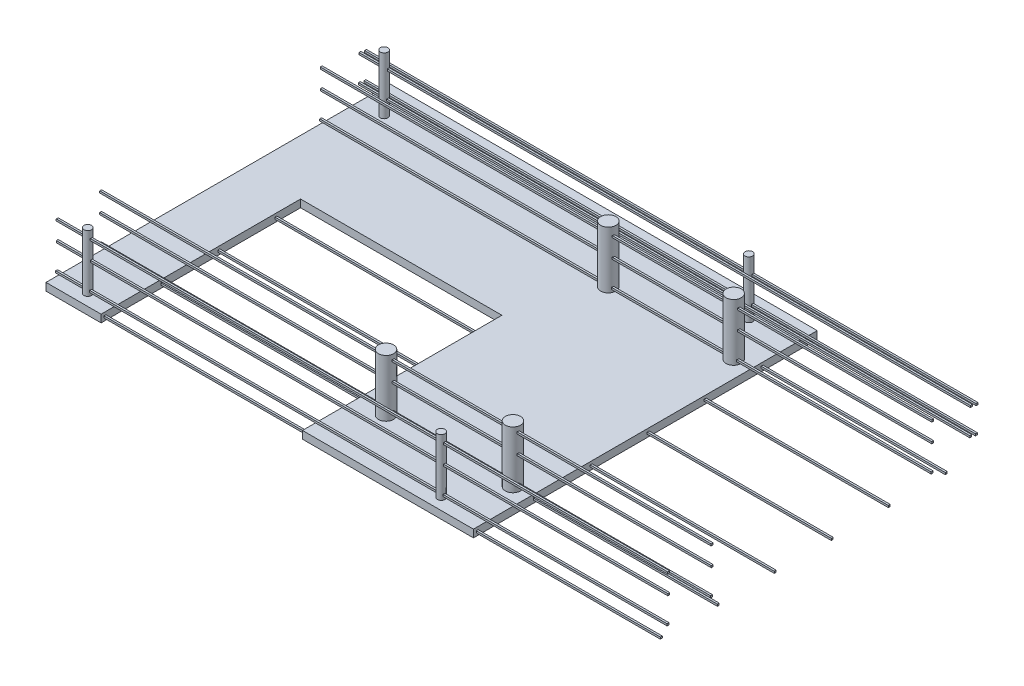
from build123d import *

# Parameters (mm, degrees)
SKETCH_1_W               = 120
SKETCH_1_H               = 120
EXTRUDE_1_DEPTH          = 2
SKETCH_2_R               = 2
SKETCH_2_R_2             = 1
EXTRUDE_2_DEPTH          = 15
SKETCH_3_W               = 53
SKETCH_3_H               = 18
SKETCH_3_W_2             = 45
SKETCH_3_W_3             = 14.5
SKETCH_3_W_4             = 7.5
SKETCH_3_H_2             = 13
SKETCH_3_H_3             = 89
CUT_EXTRUDE_3_DEPTH      = 15
SKETCH_4_W               = 53
SKETCH_4_H               = 64
CUT_EXTRUDE_4_DEPTH      = 15
CUT_EXTRUDE_5_DEPTH      = 87.168439698
CUT_EXTRUDE_5_DEPTH_BACK = 10
SKETCH_5_W               = 45
SKETCH_5_H               = 11.5
SKETCH_5_W_2             = 14.5
EXTRUDE_START            = -98
SKETCH_7_W               = 0.5
SKETCH_7_H               = 0.5
EXTRUDE_3_DEPTH          = 146.454657
EXTRUDE_START_2          = -112.5
SKETCH_8_W               = 0.5
SKETCH_8_H               = 0.5
EXTRUDE_4_DEPTH          = 160.954657


with BuildPart() as part:
    # 스케치1 → 보스-돌출1 (new body)
    with BuildSketch(Plane(origin=(0, 0, 0), x_dir=(1, 0, 0), z_dir=(0, 1, 0))):
        Rectangle(SKETCH_1_W, SKETCH_1_H)
    extrude(amount=EXTRUDE_1_DEPTH)

    # 스케치2 → 보스-돌출2 (add)
    with BuildSketch(Plane(origin=(0, 2, 0), x_dir=(1, 0, 0), z_dir=(0, 1, 0))):
        with Locations(Location((55.5, 24.5, 0), (0, 0, 270))):
            Circle(SKETCH_2_R)
        with Locations(Location((55.5, -33.6, 0), (0, 0, 270))):
            Circle(SKETCH_2_R)
        with Locations(Location((48.5, -45.5, 0), (0, 0, 270))):
            Circle(SKETCH_2_R_2)
        with Locations(Location((22.5, -34, 0), (0, 0, 270))):
            Circle(SKETCH_2_R)
        with Locations(Location((22.5, 24.5, 0), (0, 0, 270))):
            Circle(SKETCH_2_R)
        with Locations(Location((48.5, 35.5, 0), (0, 0, 270))):
            Circle(SKETCH_2_R_2)
        with Locations(Location((-46, 34, 0), (0, 0, 270))):
            Circle(SKETCH_2_R_2)
        with Locations(Location((-44.5, -45.5, 0), (0, 0, 270))):
            Circle(SKETCH_2_R_2)
    extrude(amount=EXTRUDE_2_DEPTH)

    # 스케치3 → 컷-돌출3 (cut)
    with BuildSketch(Plane(origin=(0, 2, 0), x_dir=(1, 0, 0), z_dir=(0, 1, 0))):
        with Locations((-11.5, 51)):
            Rectangle(SKETCH_3_W, SKETCH_3_H)
        with Locations((37.5, 51)):
            Rectangle(SKETCH_3_W_2, SKETCH_3_H)
        with Locations((-45.25, 51)):
            Rectangle(SKETCH_3_W_3, SKETCH_3_H)
        with Locations((-56.25, 51)):
            Rectangle(SKETCH_3_W_4, SKETCH_3_H)
        with Locations((-56.25, 35.5)):
            Rectangle(SKETCH_3_W_4, SKETCH_3_H_2)
        with Locations((-56.25, -15.5)):
            Rectangle(SKETCH_3_W_4, SKETCH_3_H_3)
    extrude(amount=-CUT_EXTRUDE_3_DEPTH, mode=Mode.SUBTRACT)

    # 스케치4 → 컷-돌출4 (cut)
    with BuildSketch(Plane(origin=(0, 2, 0), x_dir=(1, 0, 0), z_dir=(0, 1, 0))):
        with Locations((-11.5, -28)):
            Rectangle(SKETCH_4_W, SKETCH_4_H)
    extrude(amount=-CUT_EXTRUDE_4_DEPTH, mode=Mode.SUBTRACT)

    # 스케치5 → 컷-돌출5 (cut, two sides: drawn at the far end of the back side and taken through both)
    with BuildSketch(Plane(origin=(0, 2, 0), x_dir=(1, 0, 0), z_dir=(0, 1, 0)).offset(-CUT_EXTRUDE_5_DEPTH_BACK)):
        with Locations((37.5, -54.25)):
            Rectangle(SKETCH_5_W, SKETCH_5_H)
        with Locations((-45.25, -54.25)):
            Rectangle(SKETCH_5_W_2, SKETCH_5_H)
    extrude(amount=CUT_EXTRUDE_5_DEPTH + CUT_EXTRUDE_5_DEPTH_BACK, mode=Mode.SUBTRACT)

    # 스케치7 → 보스-돌출3 (add)
    with BuildSketch(Plane(origin=(60, 0, 0), x_dir=(0, 0, -1), z_dir=(1, 0, 0)).offset(EXTRUDE_START)):
        with Locations((-47.5, 1)):
            Rectangle(SKETCH_7_W, SKETCH_7_H)
        with Locations((-32.5, 1)):
            Rectangle(SKETCH_7_W, SKETCH_7_H)
        with Locations((-17.5, 1)):
            Rectangle(SKETCH_7_W, SKETCH_7_H)
        with Locations((-2.5, 1)):
            Rectangle(SKETCH_7_W, SKETCH_7_H)
        with Locations((12.5, 1)):
            Rectangle(SKETCH_7_W, SKETCH_7_H)
        with Locations((27.5, 1)):
            Rectangle(SKETCH_7_W, SKETCH_7_H)
    extrude(amount=EXTRUDE_3_DEPTH)

    # 스케치8 → 보스-돌출4 (add)
    with BuildSketch(Plane(origin=(60, 0, 0), x_dir=(0, 0, -1), z_dir=(1, 0, 0)).offset(EXTRUDE_START_2)):
        with Locations((-45.544359328, 9.924903822)):
            Rectangle(SKETCH_8_W, SKETCH_8_H)
        with Locations((-45.709125043, 3.127598255)):
            Rectangle(SKETCH_8_W, SKETCH_8_H)
        with Locations((-45.555420965, 14.878654636)):
            Rectangle(SKETCH_8_W, SKETCH_8_H)
        with Locations((-34.109907955, 10.598155556)):
            Rectangle(SKETCH_8_W, SKETCH_8_H)
        with Locations((-34.27467367, 3.800849989)):
            Rectangle(SKETCH_8_W, SKETCH_8_H)
        with Locations((-34.120969592, 15.55190637)):
            Rectangle(SKETCH_8_W, SKETCH_8_H)
        with Locations((23.953160995, 9.801704354)):
            Rectangle(SKETCH_8_W, SKETCH_8_H)
        with Locations((23.78839528, 3.004398788)):
            Rectangle(SKETCH_8_W, SKETCH_8_H)
        with Locations((23.942099358, 14.755455169)):
            Rectangle(SKETCH_8_W, SKETCH_8_H)
        with Locations((34.119951527, 12.972841822)):
            Rectangle(SKETCH_8_W, SKETCH_8_H)
        with Locations((33.955185812, 6.175536256)):
            Rectangle(SKETCH_8_W, SKETCH_8_H)
        with Locations((35.607783041, 12.660272177)):
            Rectangle(SKETCH_8_W, SKETCH_8_H)
        with Locations((35.443017325, 5.86296661)):
            Rectangle(SKETCH_8_W, SKETCH_8_H)
    extrude(amount=EXTRUDE_4_DEPTH)


solid = part.part
